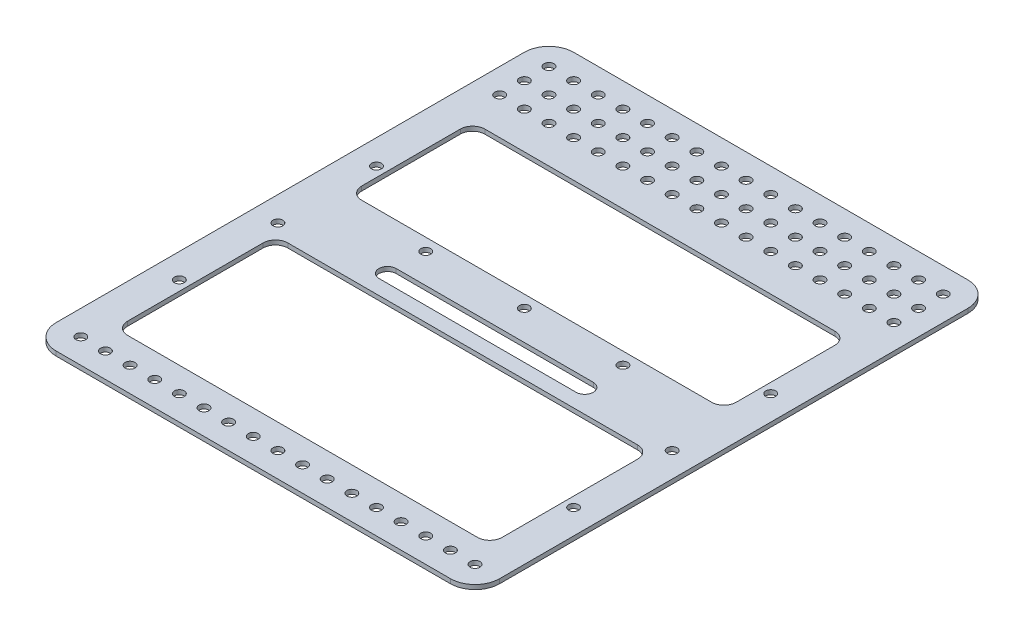
from build123d import *

# Parameters (mm, degrees)
SKETCH3_W           = 228.6
SKETCH3_H           = 266.7
SKETCH3_R           = 2.54
SKETCH3_W_2         = 193.04
SKETCH3_H_2         = 82.55
BOSS_EXTRUDE3_DEPTH = 2.286
SKETCH6_W           = 193.04
SKETCH6_H           = 19.05
BOSS_EXTRUDE4_DEPTH = 2.286
SKETCH8_R           = 2.54
BOSS_EXTRUDE5_DEPTH = 2.286
SKETCH9_R           = 2.54
CUT_EXTRUDE2_DEPTH  = 352.272082289
FILLET5_R           = 12.7
FILLET6_R           = 6.35


with BuildPart() as part:
    # Sketch3 → Boss-Extrude3 (new body)
    with BuildSketch(Plane(origin=(0, 0, 0), x_dir=(1, 0, 0), z_dir=(0, 1, 0))):
        with Locations((114.3, 133.35)):
            Rectangle(SKETCH3_W, SKETCH3_H)
        with Locations(Location((12.7, 254, 0), (0, 0, 270))):
            Circle(SKETCH3_R, mode=Mode.SUBTRACT)
        with Locations(Location((25.4, 254, 0), (0, 0, 270))):
            Circle(SKETCH3_R, mode=Mode.SUBTRACT)
        with Locations(Location((38.1, 254, 0), (0, 0, 270))):
            Circle(SKETCH3_R, mode=Mode.SUBTRACT)
        with Locations(Location((50.8, 254, 0), (0, 0, 270))):
            Circle(SKETCH3_R, mode=Mode.SUBTRACT)
        with Locations(Location((63.5, 254, 0), (0, 0, 270))):
            Circle(SKETCH3_R, mode=Mode.SUBTRACT)
        with Locations(Location((76.2, 254, 0), (0, 0, 270))):
            Circle(SKETCH3_R, mode=Mode.SUBTRACT)
        with Locations(Location((88.9, 254, 0), (0, 0, 270))):
            Circle(SKETCH3_R, mode=Mode.SUBTRACT)
        with Locations(Location((101.6, 254, 0), (0, 0, 270))):
            Circle(SKETCH3_R, mode=Mode.SUBTRACT)
        with Locations(Location((114.3, 254, 0), (0, 0, 270))):
            Circle(SKETCH3_R, mode=Mode.SUBTRACT)
        with Locations(Location((127, 254, 0), (0, 0, 270))):
            Circle(SKETCH3_R, mode=Mode.SUBTRACT)
        with Locations(Location((139.7, 254, 0), (0, 0, 270))):
            Circle(SKETCH3_R, mode=Mode.SUBTRACT)
        with Locations(Location((152.4, 254, 0), (0, 0, 270))):
            Circle(SKETCH3_R, mode=Mode.SUBTRACT)
        with Locations(Location((165.1, 254, 0), (0, 0, 270))):
            Circle(SKETCH3_R, mode=Mode.SUBTRACT)
        with Locations(Location((177.8, 254, 0), (0, 0, 270))):
            Circle(SKETCH3_R, mode=Mode.SUBTRACT)
        with Locations(Location((190.5, 254, 0), (0, 0, 270))):
            Circle(SKETCH3_R, mode=Mode.SUBTRACT)
        with Locations(Location((203.2, 254, 0), (0, 0, 270))):
            Circle(SKETCH3_R, mode=Mode.SUBTRACT)
        with Locations(Location((215.9, 254, 0), (0, 0, 270))):
            Circle(SKETCH3_R, mode=Mode.SUBTRACT)
        with Locations(Location((25.4, 241.3, 0), (0, 0, 270))):
            Circle(SKETCH3_R, mode=Mode.SUBTRACT)
        with Locations(Location((38.1, 241.3, 0), (0, 0, 270))):
            Circle(SKETCH3_R, mode=Mode.SUBTRACT)
        with Locations(Location((50.8, 241.3, 0), (0, 0, 270))):
            Circle(SKETCH3_R, mode=Mode.SUBTRACT)
        with Locations(Location((63.5, 241.3, 0), (0, 0, 270))):
            Circle(SKETCH3_R, mode=Mode.SUBTRACT)
        with Locations(Location((76.2, 241.3, 0), (0, 0, 270))):
            Circle(SKETCH3_R, mode=Mode.SUBTRACT)
        with Locations(Location((88.9, 241.3, 0), (0, 0, 270))):
            Circle(SKETCH3_R, mode=Mode.SUBTRACT)
        with Locations(Location((101.6, 241.3, 0), (0, 0, 270))):
            Circle(SKETCH3_R, mode=Mode.SUBTRACT)
        with Locations(Location((114.3, 241.3, 0), (0, 0, 270))):
            Circle(SKETCH3_R, mode=Mode.SUBTRACT)
        with Locations(Location((127, 241.3, 0), (0, 0, 270))):
            Circle(SKETCH3_R, mode=Mode.SUBTRACT)
        with Locations(Location((139.7, 241.3, 0), (0, 0, 270))):
            Circle(SKETCH3_R, mode=Mode.SUBTRACT)
        with Locations(Location((152.4, 241.3, 0), (0, 0, 270))):
            Circle(SKETCH3_R, mode=Mode.SUBTRACT)
        with Locations(Location((165.1, 241.3, 0), (0, 0, 270))):
            Circle(SKETCH3_R, mode=Mode.SUBTRACT)
        with Locations(Location((177.8, 241.3, 0), (0, 0, 270))):
            Circle(SKETCH3_R, mode=Mode.SUBTRACT)
        with Locations(Location((190.5, 241.3, 0), (0, 0, 270))):
            Circle(SKETCH3_R, mode=Mode.SUBTRACT)
        with Locations(Location((203.2, 241.3, 0), (0, 0, 270))):
            Circle(SKETCH3_R, mode=Mode.SUBTRACT)
        with Locations(Location((215.9, 241.3, 0), (0, 0, 270))):
            Circle(SKETCH3_R, mode=Mode.SUBTRACT)
        with Locations(Location((25.4, 228.6, 0), (0, 0, 270))):
            Circle(SKETCH3_R, mode=Mode.SUBTRACT)
        with Locations(Location((38.1, 228.6, 0), (0, 0, 270))):
            Circle(SKETCH3_R, mode=Mode.SUBTRACT)
        with Locations(Location((50.8, 228.6, 0), (0, 0, 270))):
            Circle(SKETCH3_R, mode=Mode.SUBTRACT)
        with Locations(Location((63.5, 228.6, 0), (0, 0, 270))):
            Circle(SKETCH3_R, mode=Mode.SUBTRACT)
        with Locations(Location((76.2, 228.6, 0), (0, 0, 270))):
            Circle(SKETCH3_R, mode=Mode.SUBTRACT)
        with Locations(Location((88.9, 228.6, 0), (0, 0, 270))):
            Circle(SKETCH3_R, mode=Mode.SUBTRACT)
        with Locations(Location((101.6, 228.6, 0), (0, 0, 270))):
            Circle(SKETCH3_R, mode=Mode.SUBTRACT)
        with Locations(Location((114.3, 228.6, 0), (0, 0, 270))):
            Circle(SKETCH3_R, mode=Mode.SUBTRACT)
        with Locations(Location((127, 228.6, 0), (0, 0, 270))):
            Circle(SKETCH3_R, mode=Mode.SUBTRACT)
        with Locations(Location((139.7, 228.6, 0), (0, 0, 270))):
            Circle(SKETCH3_R, mode=Mode.SUBTRACT)
        with Locations(Location((152.4, 228.6, 0), (0, 0, 270))):
            Circle(SKETCH3_R, mode=Mode.SUBTRACT)
        with Locations(Location((165.1, 228.6, 0), (0, 0, 270))):
            Circle(SKETCH3_R, mode=Mode.SUBTRACT)
        with Locations(Location((177.8, 228.6, 0), (0, 0, 270))):
            Circle(SKETCH3_R, mode=Mode.SUBTRACT)
        with Locations(Location((190.5, 228.6, 0), (0, 0, 270))):
            Circle(SKETCH3_R, mode=Mode.SUBTRACT)
        with Locations(Location((203.2, 228.6, 0), (0, 0, 270))):
            Circle(SKETCH3_R, mode=Mode.SUBTRACT)
        with Locations(Location((215.9, 228.6, 0), (0, 0, 270))):
            Circle(SKETCH3_R, mode=Mode.SUBTRACT)
        with Locations(Location((12.7, 241.3, 0), (0, 0, 270))):
            Circle(SKETCH3_R, mode=Mode.SUBTRACT)
        with Locations(Location((12.7, 228.6, 0), (0, 0, 270))):
            Circle(SKETCH3_R, mode=Mode.SUBTRACT)
        with Locations(Location((12.7, 12.7, 0), (0, 0, 270))):
            Circle(SKETCH3_R, mode=Mode.SUBTRACT)
        with Locations(Location((25.4, 12.7, 0), (0, 0, 270))):
            Circle(SKETCH3_R, mode=Mode.SUBTRACT)
        with Locations(Location((38.1, 12.7, 0), (0, 0, 270))):
            Circle(SKETCH3_R, mode=Mode.SUBTRACT)
        with Locations(Location((50.8, 12.7, 0), (0, 0, 270))):
            Circle(SKETCH3_R, mode=Mode.SUBTRACT)
        with Locations(Location((63.5, 12.7, 0), (0, 0, 270))):
            Circle(SKETCH3_R, mode=Mode.SUBTRACT)
        with Locations(Location((76.2, 12.7, 0), (0, 0, 270))):
            Circle(SKETCH3_R, mode=Mode.SUBTRACT)
        with Locations(Location((88.9, 12.7, 0), (0, 0, 270))):
            Circle(SKETCH3_R, mode=Mode.SUBTRACT)
        with Locations(Location((101.6, 12.7, 0), (0, 0, 270))):
            Circle(SKETCH3_R, mode=Mode.SUBTRACT)
        with Locations(Location((114.3, 12.7, 0), (0, 0, 270))):
            Circle(SKETCH3_R, mode=Mode.SUBTRACT)
        with Locations(Location((127, 12.7, 0), (0, 0, 270))):
            Circle(SKETCH3_R, mode=Mode.SUBTRACT)
        with Locations(Location((139.7, 12.7, 0), (0, 0, 270))):
            Circle(SKETCH3_R, mode=Mode.SUBTRACT)
        with Locations(Location((152.4, 12.7, 0), (0, 0, 270))):
            Circle(SKETCH3_R, mode=Mode.SUBTRACT)
        with Locations(Location((165.1, 12.7, 0), (0, 0, 270))):
            Circle(SKETCH3_R, mode=Mode.SUBTRACT)
        with Locations(Location((177.8, 12.7, 0), (0, 0, 270))):
            Circle(SKETCH3_R, mode=Mode.SUBTRACT)
        with Locations(Location((190.5, 12.7, 0), (0, 0, 270))):
            Circle(SKETCH3_R, mode=Mode.SUBTRACT)
        with Locations(Location((203.2, 12.7, 0), (0, 0, 270))):
            Circle(SKETCH3_R, mode=Mode.SUBTRACT)
        with Locations(Location((215.9, 12.7, 0), (0, 0, 270))):
            Circle(SKETCH3_R, mode=Mode.SUBTRACT)
        with Locations(Location((12.7, 114.3, 0), (0, 0, 270))):
            Circle(SKETCH3_R, mode=Mode.SUBTRACT)
        with Locations(Location((63.5, 114.3, 0), (0, 0, 270))):
            Circle(SKETCH3_R, mode=Mode.SUBTRACT)
        with Locations(Location((114.3, 114.3, 0), (0, 0, 270))):
            Circle(SKETCH3_R, mode=Mode.SUBTRACT)
        with Locations(Location((165.1, 114.3, 0), (0, 0, 270))):
            Circle(SKETCH3_R, mode=Mode.SUBTRACT)
        with Locations(Location((215.9, 114.3, 0), (0, 0, 270))):
            Circle(SKETCH3_R, mode=Mode.SUBTRACT)
        with Locations(Location((12.7, 165.1, 0), (0, 0, 270))):
            Circle(SKETCH3_R, mode=Mode.SUBTRACT)
        with Locations(Location((215.9, 165.1, 0), (0, 0, 270))):
            Circle(SKETCH3_R, mode=Mode.SUBTRACT)
        with Locations(Location((12.7, 63.5, 0), (0, 0, 270))):
            Circle(SKETCH3_R, mode=Mode.SUBTRACT)
        with Locations(Location((215.9, 63.5, 0), (0, 0, 270))):
            Circle(SKETCH3_R, mode=Mode.SUBTRACT)
        with Locations((114.3, 66.675)):
            Rectangle(SKETCH3_W_2, SKETCH3_H_2, mode=Mode.SUBTRACT)
        with Locations((114.3, 168.275)):
            Rectangle(SKETCH3_W_2, SKETCH3_H_2, mode=Mode.SUBTRACT)
    extrude(amount=BOSS_EXTRUDE3_DEPTH)

    # Sketch6 → Boss-Extrude4 (add)
    with BuildSketch(Plane(origin=(0, 2.286, 0), x_dir=(1, 0, 0), z_dir=(0, 1, 0))):
        with Locations((114.3, 136.525)):
            Rectangle(SKETCH6_W, SKETCH6_H)
    extrude(amount=-BOSS_EXTRUDE4_DEPTH)

    # Sketch8 → Boss-Extrude5 (add, through all)
    with BuildSketch(Plane(origin=(0, 2.286, 0), x_dir=(1, 0, 0), z_dir=(0, 1, 0))):
        with Locations((63.5, 114.3)):
            Circle(SKETCH8_R)
        with Locations((114.3, 114.3)):
            Circle(SKETCH8_R)
        with Locations((165.1, 114.3)):
            Circle(SKETCH8_R)
    extrude(amount=-BOSS_EXTRUDE5_DEPTH)

    # Sketch9 → Cut-Extrude2 (cut, through all)
    with BuildSketch(Plane(origin=(0, 2.286, 0), x_dir=(1, 0, 0), z_dir=(0, 1, 0))):
        with Locations(Location((165.1, 139.7, 0), (0, 0, 270))):
            Circle(SKETCH9_R)
        with Locations(Location((114.3, 139.7, 0), (0, 0, 270))):
            Circle(SKETCH9_R)
        with Locations(Location((63.5, 139.7, 0), (0, 0, 270))):
            Circle(SKETCH9_R)
        with BuildLine():
            Line((165.1, 115.57), (63.5, 115.57))
            ThreePointArc((63.5, 115.57), (59.055, 120.015), (63.5, 124.46))
            Line((63.5, 124.46), (165.1, 124.46))
            ThreePointArc((165.1, 124.46), (169.545, 120.015), (165.1, 115.57))
        make_face()
    extrude(amount=-CUT_EXTRUDE2_DEPTH, mode=Mode.SUBTRACT)

    # Fillet5
    fillet5_edges = [part.edges().sort_by_distance(p)[0] for p in [
        (0, 1.143, -266.7),
        (228.6, 1.143, -266.7),
        (228.6, 1.143, 0),
        (0, 1.143, 0),
    ]]
    fillet(fillet5_edges, radius=FILLET5_R)

    # Fillet6
    fillet6_edges = [part.edges().sort_by_distance(p)[0] for p in [
        (210.82, 1.143, -107.95),
        (17.78, 1.143, -107.95),
        (17.78, 1.143, -25.4),
        (210.82, 1.143, -25.4),
        (17.78, 1.143, -209.55),
        (210.82, 1.143, -209.55),
        (17.78, 1.143, -146.05),
        (210.82, 1.143, -146.05),
    ]]
    fillet(fillet6_edges, radius=FILLET6_R)


solid = part.part
